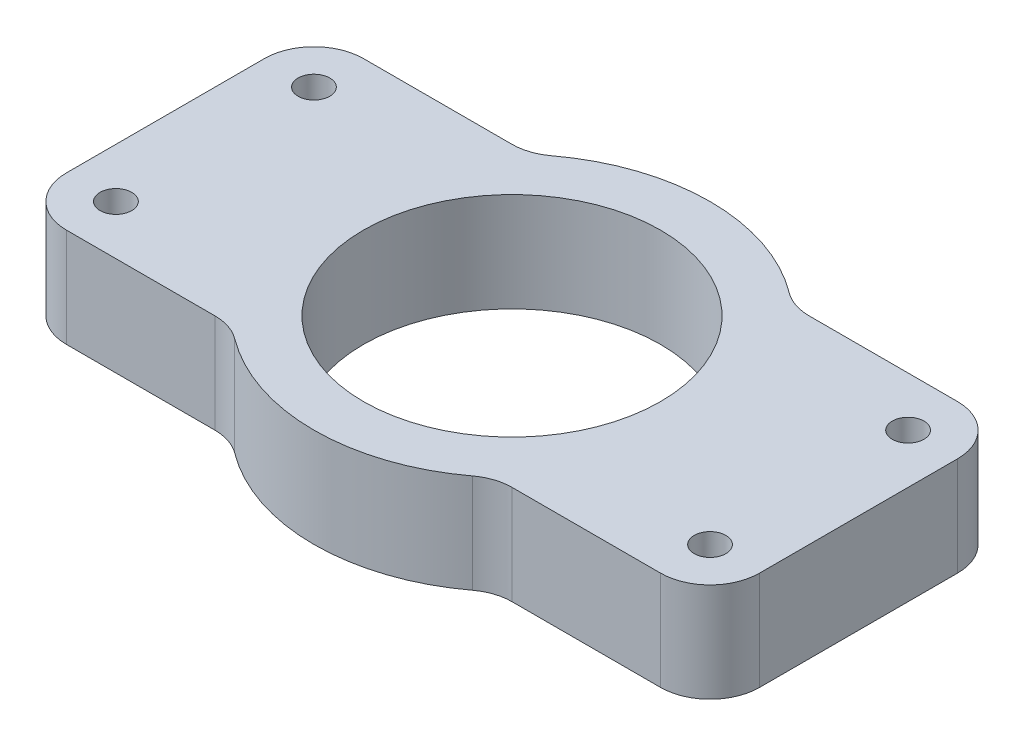
from build123d import *

# Parameters (mm, degrees)
SKETCH1_W               = 70
SKETCH1_H               = 30
BOSS_EXTRUDE1_DEPTH     = 10
SKETCH2_R               = 20
BOSS_EXTRUDE2_DEPTH     = 10
CUT_EXTRUDE1_DEPTH      = 42.533119315
CUT_EXTRUDE1_DEPTH_BACK = 42.533119315
SKETCH3_R               = 15
CUT_EXTRUDE2_DEPTH      = 42.533119315
CUT_EXTRUDE2_DEPTH_BACK = 42.533119315
SKETCH4_R               = 1.6
FILLET1_R               = 5


with BuildPart() as part:
    # Sketch1 → Boss-Extrude1 (new body)
    with BuildSketch(Plane(origin=(0, 0, 0), x_dir=(1, 0, 0), z_dir=(0, 1, 0))):
        Rectangle(SKETCH1_W, SKETCH1_H)
    extrude(amount=BOSS_EXTRUDE1_DEPTH)

    # Sketch2 → Boss-Extrude2 (add)
    with BuildSketch(Plane(origin=(0, 0, 0), x_dir=(1, 0, 0), z_dir=(0, 1, 0))):
        Circle(SKETCH2_R)
    extrude(amount=BOSS_EXTRUDE2_DEPTH)

    # Sketch3 → Cut-Extrude1 (cut, two sides: drawn at the far end of the back side and taken through both)
    with BuildSketch(Plane(origin=(0, 10, 0), x_dir=(1, 0, 0), z_dir=(0, 1, 0)).offset(-CUT_EXTRUDE1_DEPTH_BACK)):
        with Locations(Location((0, 0, 0), (0, 0, 270))):
            Circle(SKETCH3_R)
    extrude(amount=CUT_EXTRUDE1_DEPTH + CUT_EXTRUDE1_DEPTH_BACK, mode=Mode.SUBTRACT)

    # Sketch4 → Cut-Extrude2 (cut, two sides: drawn at the far end of the back side and taken through both)
    with BuildSketch(Plane(origin=(0, 10, 0), x_dir=(1, 0, 0), z_dir=(0, 1, 0)).offset(-CUT_EXTRUDE2_DEPTH_BACK)):
        with Locations(Location((-30, 10, 0), (0, 0, 270))):
            Circle(SKETCH4_R)
        with Locations(Location((30, -10, 0), (0, 0, 270))):
            Circle(SKETCH4_R)
        with Locations(Location((30, 10, 0), (0, 0, 270))):
            Circle(SKETCH4_R)
        with Locations(Location((-30, -10, 0), (0, 0, 270))):
            Circle(SKETCH4_R)
    extrude(amount=CUT_EXTRUDE2_DEPTH + CUT_EXTRUDE2_DEPTH_BACK, mode=Mode.SUBTRACT)

    # Fillet1
    fillet1_edges = [part.edges().sort_by_distance(p)[0] for p in [
        (-13.228756555, 5, -15),
        (13.228756555, 5, -15),
        (13.228756555, 5, 15),
        (-13.228756555, 5, 15),
        (35, 5, 15),
        (-35, 5, 15),
        (-35, 5, -15),
        (35, 5, -15),
    ]]
    fillet(fillet1_edges, radius=FILLET1_R)


solid = part.part
